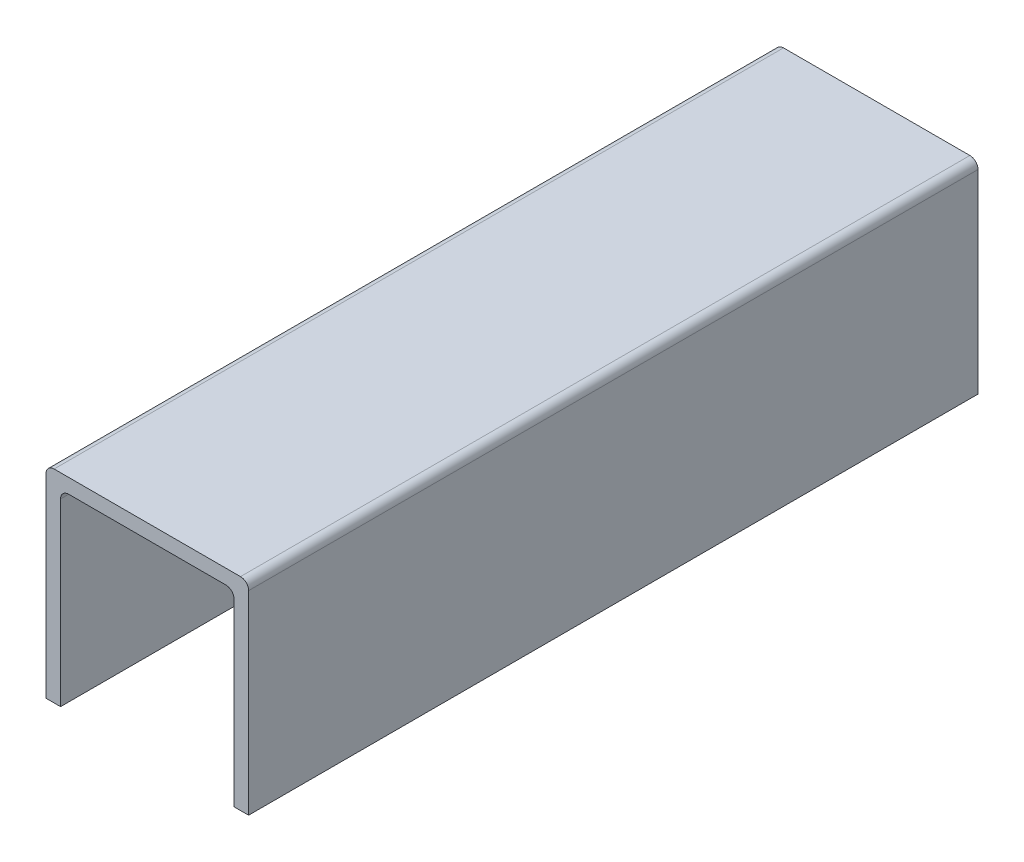
from build123d import *

# Parameters (mm, degrees)
BOSS_EXTRUDE1_DEPTH = 180
FILLET1_R           = 2


with BuildPart() as part:
    # Sketch1 → Boss-Extrude1 (new body)
    with BuildSketch(Plane.XY):
        Polygon((0, 0), (0, 50), (50, 50), (50, 0), (46.405, 0), (46.405, 46.405), (3.595, 46.405), (3.595, 0), align=None)
    extrude(amount=BOSS_EXTRUDE1_DEPTH)

    # Fillet1
    fillet1_edges = [part.edges().sort_by_distance(p)[0] for p in [
        (0, 50, 90),
        (50, 50, 90),
        (46.405, 46.405, 90),
        (3.595, 46.405, 90),
    ]]
    fillet(fillet1_edges, radius=FILLET1_R)


solid = part.part
